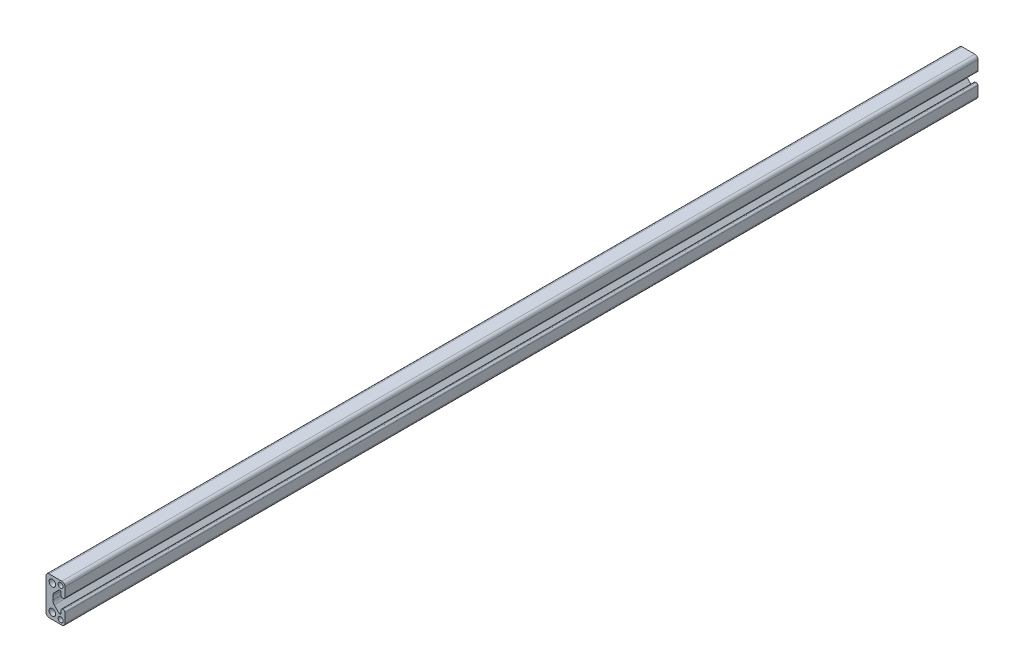
from build123d import *

# Parameters (mm, degrees)
SKETCH3_R           = 2.201333333
SKETCH3_R_2         = 1.693333333
BOSS_EXTRUDE1_DEPTH = 914.4
CUT_EXTRUDE1_START  = -1219.2
CUT_EXTRUDE1_DEPTH  = 1219.2


with BuildPart() as part:
    # Sketch3 → Boss-Extrude1 (new, symmetric)
    with BuildSketch(Plane.XY):
        with BuildLine():
            Line((-1.778, 0), (-1.778, 1.27))
            ThreePointArc((-1.778, 1.27), (-1.536070654, 2.494011801), (-0.846666667, 3.533942971))
            Line((-0.846666667, 3.533942971), (2.413267273, 6.793876912))
            ThreePointArc((2.413267273, 6.793876912), (2.578074335, 6.903997469), (2.772477518, 6.942666667))
            Line((2.772477518, 6.942666667), (3.048, 6.942666667))
            ThreePointArc((3.048, 6.942666667), (3.467078619, 6.769078619), (3.640666667, 6.35))
            Line((3.640666667, 6.35), (3.640666667, 4.301066667))
            ThreePointArc((3.640666667, 4.301066667), (3.948165494, 3.558698827), (4.690533333, 3.2512))
            Line((4.690533333, 3.2512), (5.300133333, 3.2512))
            ThreePointArc((5.300133333, 3.2512), (6.042501173, 3.558698827), (6.35, 4.301066667))
            Line((6.35, 4.301066667), (6.35, 10.583333333))
            ThreePointArc((6.35, 10.583333333), (5.730042687, 12.080042687), (4.233333333, 12.7))
            Line((4.233333333, 12.7), (-4.233333333, 12.7))
            ThreePointArc((-4.233333333, 12.7), (-5.730042687, 12.080042687), (-6.35, 10.583333333))
            Line((-6.35, 10.583333333), (-6.35, 0))
            Line((-6.35, 0), (-1.778, 0))
        make_face()
        with Locations(Location((-2.116666667, 8.466666667, 0), (0, 0, 180))):
            Circle(SKETCH3_R, mode=Mode.SUBTRACT)
        with Locations(Location((3.429, 9.906, 0), (0, 0, 180))):
            Circle(SKETCH3_R_2, mode=Mode.SUBTRACT)
    extrude(amount=BOSS_EXTRUDE1_DEPTH, both=True)

    # Mirror1: part across plane


with BuildPart() as part_1:
    add(part.part)
    add(part.part.mirror(Plane.ZX))

    # Sketch4 → Cut-Extrude1 (cut)
    with BuildSketch(Plane(origin=(0, 0, -914.4), x_dir=(-1, 0, 0), z_dir=(0, 0, -1)).offset(CUT_EXTRUDE1_START)):
        with BuildLine():
            Line((1.778, 1.27), (1.778, -1.27))
            ThreePointArc((1.778, -1.27), (1.536070654, -2.494011801), (0.846666667, -3.533942971))
            Line((0.846666667, -3.533942971), (-2.413267273, -6.793876912))
            ThreePointArc((-2.413267273, -6.793876912), (-2.578074335, -6.903997469), (-2.772477518, -6.942666667))
            Line((-2.772477518, -6.942666667), (-3.048, -6.942666667))
            ThreePointArc((-3.048, -6.942666667), (-3.467078619, -6.769078619), (-3.640666667, -6.35))
            Line((-3.640666667, -6.35), (-3.640666667, -4.301066667))
            ThreePointArc((-3.640666667, -4.301066667), (-3.948165494, -3.558698827), (-4.690533333, -3.2512))
            Line((-4.690533333, -3.2512), (-5.300133333, -3.2512))
            ThreePointArc((-5.300133333, -3.2512), (-6.042501173, -3.558698827), (-6.35, -4.301066667))
            Line((-6.35, -4.301066667), (-6.35, -10.583333333))
            ThreePointArc((-6.35, -10.583333333), (-5.730042687, -12.080042687), (-4.233333333, -12.7))
            Line((-4.233333333, -12.7), (4.233333333, -12.7))
            ThreePointArc((4.233333333, -12.7), (5.730042687, -12.080042687), (6.35, -10.583333333))
            Line((6.35, -10.583333333), (6.35, 10.583333333))
            ThreePointArc((6.35, 10.583333333), (5.730042687, 12.080042687), (4.233333333, 12.7))
            Line((4.233333333, 12.7), (-4.233333333, 12.7))
            ThreePointArc((-4.233333333, 12.7), (-5.730042687, 12.080042687), (-6.35, 10.583333333))
            Line((-6.35, 10.583333333), (-6.35, 4.301066667))
            ThreePointArc((-6.35, 4.301066667), (-6.042501173, 3.558698827), (-5.300133333, 3.2512))
            Line((-5.300133333, 3.2512), (-4.690533333, 3.2512))
            ThreePointArc((-4.690533333, 3.2512), (-3.948165494, 3.558698827), (-3.640666667, 4.301066667))
            Line((-3.640666667, 4.301066667), (-3.640666667, 6.35))
            ThreePointArc((-3.640666667, 6.35), (-3.467078619, 6.769078619), (-3.048, 6.942666667))
            Line((-3.048, 6.942666667), (-2.772477518, 6.942666667))
            ThreePointArc((-2.772477518, 6.942666667), (-2.578074335, 6.903997469), (-2.413267273, 6.793876912))
            Line((-2.413267273, 6.793876912), (0.846666667, 3.533942971))
            ThreePointArc((0.846666667, 3.533942971), (1.536070654, 2.494011801), (1.778, 1.27))
        make_face()
    extrude(amount=CUT_EXTRUDE1_DEPTH, mode=Mode.SUBTRACT)


solid = part_1.part
